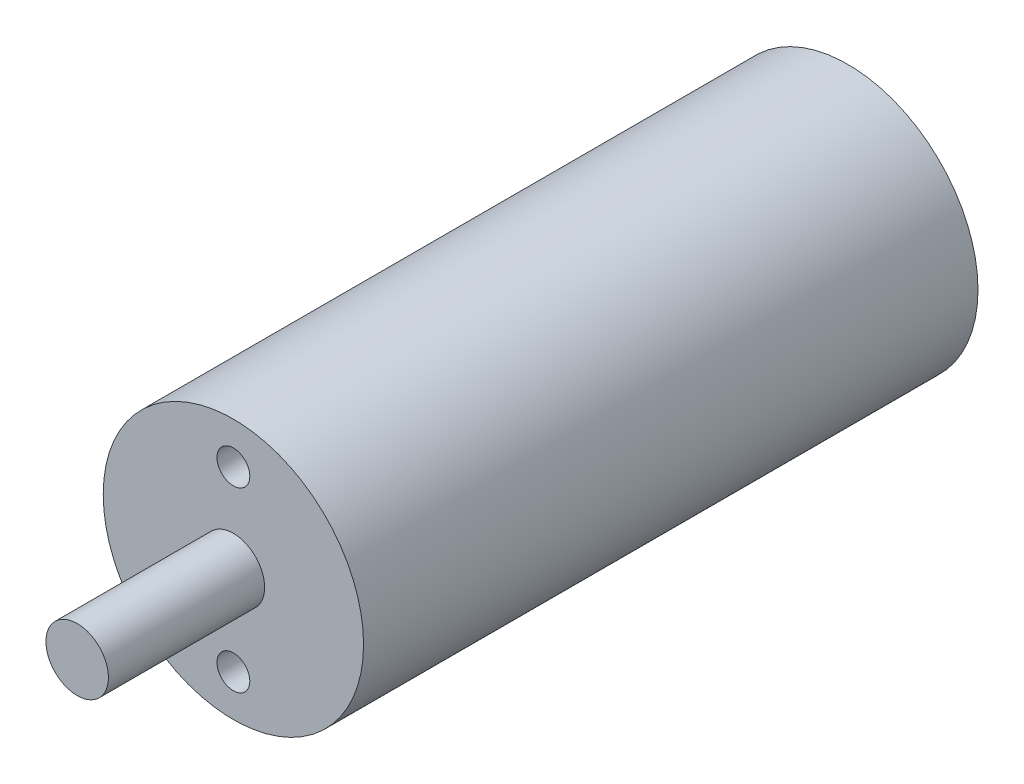
from build123d import *

# Parameters (mm, degrees)
SKETCH1_R           = 12.5
BOSS_EXTRUDE1_DEPTH = 59
SKETCH2_R           = 1.575
CUT_EXTRUDE1_DEPTH  = 12.7
SKETCH3_R           = 3
BOSS_EXTRUDE2_DEPTH = 15


with BuildPart() as part:
    # Sketch1 → Boss-Extrude1 (new body)
    with BuildSketch(Plane.XY):
        with Locations((-10.391437804, 5.875911401)):
            Circle(SKETCH1_R)
    extrude(amount=BOSS_EXTRUDE1_DEPTH)

    # Sketch2 → Cut-Extrude1 (cut)
    with BuildSketch(Plane.XY.offset(59)):
        with Locations((-10.391437804, 14.397611401)):
            Circle(SKETCH2_R)
        with Locations(Location((-10.391437804, -2.645788599, 0), (0, 0, 180))):
            Circle(SKETCH2_R)
    extrude(amount=-CUT_EXTRUDE1_DEPTH, mode=Mode.SUBTRACT)

    # Sketch3 → Boss-Extrude2 (add)
    with BuildSketch(Plane.XY.offset(59)):
        with Locations((-10.391437804, 5.875911401)):
            Circle(SKETCH3_R)
    extrude(amount=BOSS_EXTRUDE2_DEPTH)


solid = part.part
